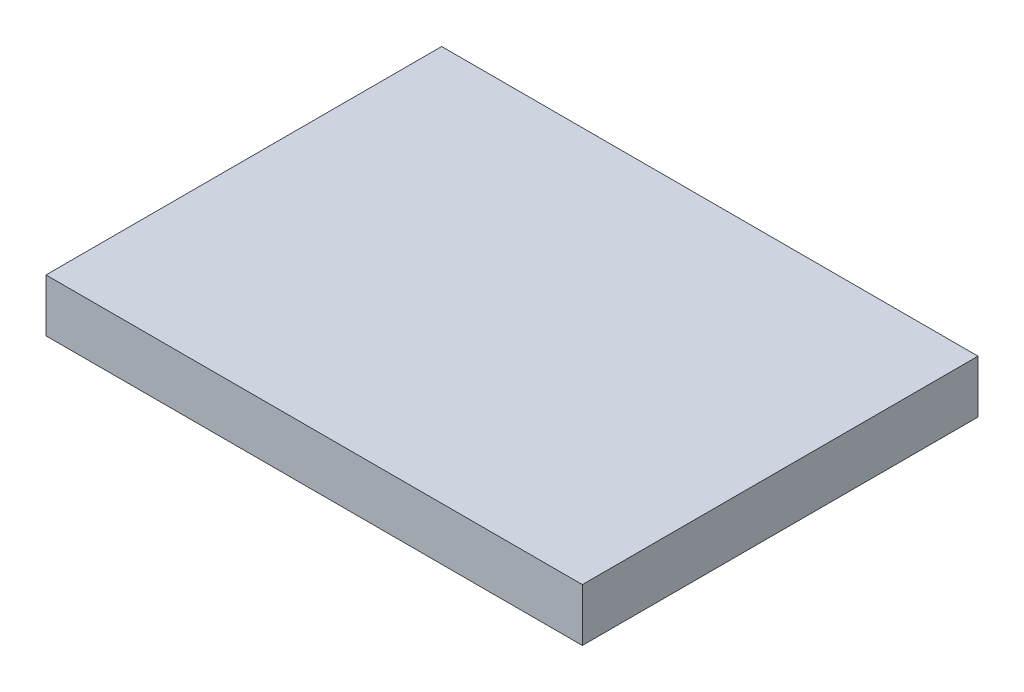
from build123d import *

# Parameters (mm, degrees)
SKETCH1_W           = 61
SKETCH1_H           = 45
BOSS_EXTRUDE1_DEPTH = 6


with BuildPart() as part:
    # Sketch1 → Boss-Extrude1 (new body)
    with BuildSketch(Plane(origin=(0, 0, 0), x_dir=(1, 0, 0), z_dir=(0, 1, 0))):
        Rectangle(SKETCH1_W, SKETCH1_H)
    extrude(amount=BOSS_EXTRUDE1_DEPTH)


solid = part.part
